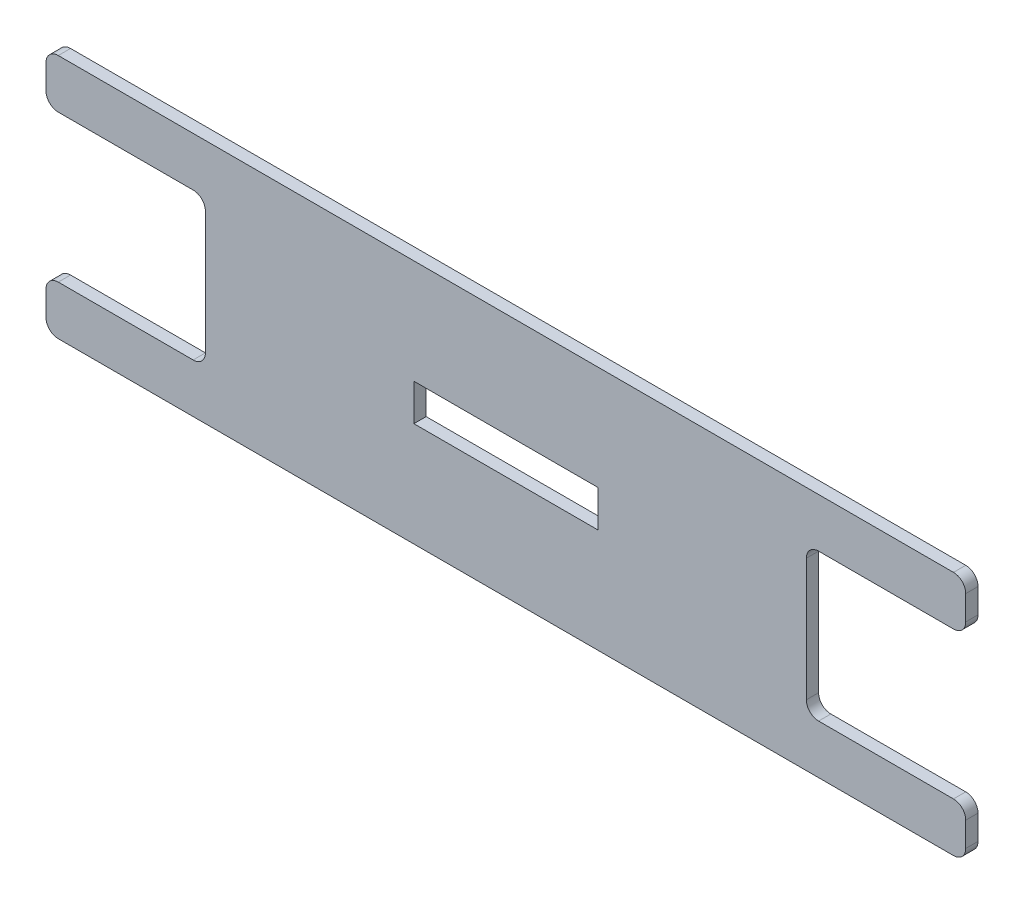
from build123d import *

# Parameters (mm, degrees)
SKETCH1_W           = 75
SKETCH1_H           = 20
BOSS_EXTRUDE1_DEPTH = 1
CUT_EXTRUDE1_DEPTH  = 39.823317736
FILLET1_R           = 1
FILLET2_R           = 1
SKETCH3_W           = 15
SKETCH3_H           = 3
CUT_EXTRUDE2_DEPTH  = 1.25


with BuildPart() as part:
    # Sketch1 → Boss-Extrude1 (new body)
    with BuildSketch(Plane.XY):
        Rectangle(SKETCH1_W, SKETCH1_H)
    extrude(amount=BOSS_EXTRUDE1_DEPTH)

    # Sketch2 → Cut-Extrude1 (cut, through all)
    with BuildSketch(Plane.XY.offset(1)):
        with BuildLine():
            Line((-37.5, 6), (-24.5, 6))
            Line((-24.5, 6), (-24.5, -6))
            Line((-24.5, -6), (-37.5, -6))
            ThreePointArc((-37.5, -6), (-43.5, 0), (-37.5, 6))
        make_face()
    cut_extrude1 = extrude(amount=-CUT_EXTRUDE1_DEPTH, mode=Mode.SUBTRACT)

    # Fillet1
    fillet1_edges = [part.edges().sort_by_distance(p)[0] for p in [
        (-37.5, -6, 0.5),
        (-37.5, 6, 0.5),
        (-24.5, 6, 0.5),
        (-24.5, -6, 0.5),
        (-37.5, 10, 0.5),
        (-37.5, -10, 0.5),
    ]]
    fillet(fillet1_edges, radius=FILLET1_R)

    # Mirror1: Cut-Extrude1 across plane
    add(cut_extrude1.mirror(Plane(origin=(0, 0, 0), x_dir=(0, 0, 1), z_dir=(1, 0, 0))), mode=Mode.SUBTRACT)

    # Fillet2
    fillet2_edges = [part.edges().sort_by_distance(p)[0] for p in [
        (37.5, 6, 0.5),
        (37.5, -6, 0.5),
        (24.5, -6, 0.5),
        (24.5, 6, 0.5),
        (37.5, 10, 0.5),
        (37.5, -10, 0.5),
    ]]
    fillet(fillet2_edges, radius=FILLET2_R)

    # Sketch3 → Cut-Extrude2 (cut)
    with BuildSketch(Plane.XY.offset(1)):
        Rectangle(SKETCH3_W, SKETCH3_H)
    extrude(amount=-CUT_EXTRUDE2_DEPTH, mode=Mode.SUBTRACT)


solid = part.part
